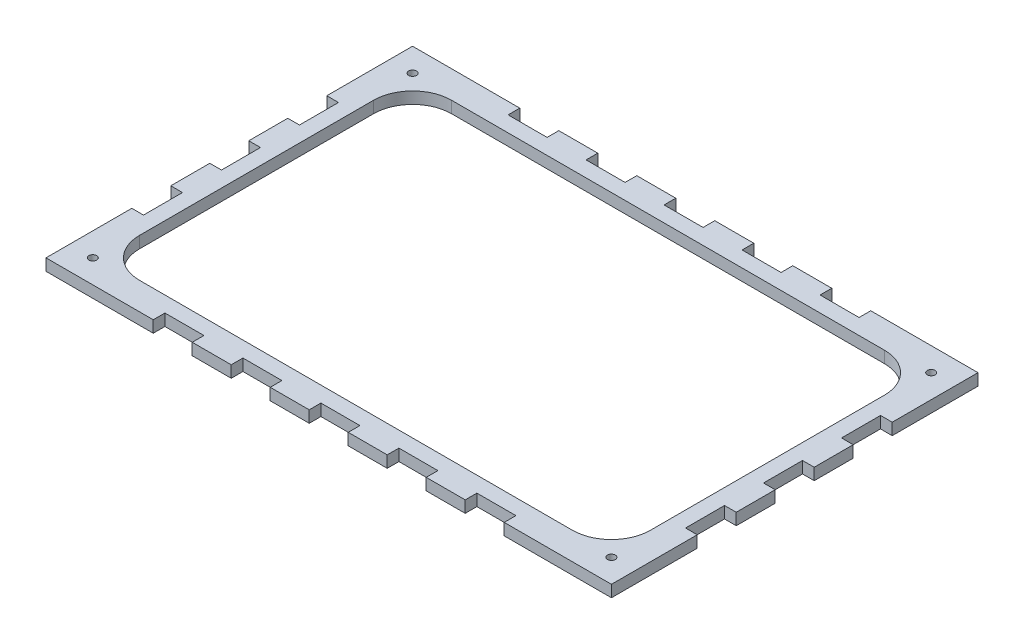
from build123d import *

# Parameters (mm, degrees)
SKETCH1_W           = 145
SKETCH1_H           = 94
BOSS_EXTRUDE1_DEPTH = 3
SKETCH2_W           = 131
SKETCH2_H           = 80
CUT_EXTRUDE1_DEPTH  = 173.829395648
FILLET1_R           = 10
SKETCH3_R           = 1
CUT_EXTRUDE2_DEPTH  = 173.829395648
SKETCH8_W           = 10
SKETCH8_H           = 3
CUT_EXTRUDE5_DEPTH  = 173.829395648
LPATTERN3_COUNT     = 4
LPATTERN3_PITCH     = 20
LPATTERN3_COL_COUNT = 4
LPATTERN3_COL_PITCH = 20
SKETCH9_W           = 3
SKETCH9_H           = 10
CUT_EXTRUDE6_DEPTH  = 173.829395648
LPATTERN4_COUNT     = 3
LPATTERN4_PITCH     = 20
LPATTERN4_COL_COUNT = 3
LPATTERN4_COL_PITCH = 20
SKETCH11_W          = 3
SKETCH11_H          = 10
SKETCH11_W_2        = 10
SKETCH11_H_2        = 3
BOSS_EXTRUDE4_DEPTH = 3


with BuildPart() as part:
    # Sketch1 → Boss-Extrude1 (new body)
    with BuildSketch(Plane(origin=(0, 0, 0), x_dir=(1, 0, 0), z_dir=(0, 1, 0))):
        with Locations((72.5, -47)):
            Rectangle(SKETCH1_W, SKETCH1_H)
    extrude(amount=BOSS_EXTRUDE1_DEPTH)

    # Sketch2 → Cut-Extrude1 (cut, through all)
    with BuildSketch(Plane(origin=(0, 3, 0), x_dir=(1, 0, 0), z_dir=(0, 1, 0))):
        with Locations((72.5, -47)):
            Rectangle(SKETCH2_W, SKETCH2_H)
    extrude(amount=-CUT_EXTRUDE1_DEPTH, mode=Mode.SUBTRACT)

    # Fillet1
    fillet1_edges = [part.edges().sort_by_distance(p)[0] for p in [
        (7, 1.5, 87),
        (7, 1.5, 7),
        (138, 1.5, 7),
        (138, 1.5, 87),
    ]]
    fillet(fillet1_edges, radius=FILLET1_R)

    # Sketch3 → Cut-Extrude2 (cut, through all)
    with BuildSketch(Plane.XZ):
        with Locations(Location((6, 88, 0), (0, 0, 270))):
            Circle(SKETCH3_R)
        with Locations(Location((139, 88, 0), (0, 0, 270))):
            Circle(SKETCH3_R)
        with Locations(Location((139, 6, 0), (0, 0, 270))):
            Circle(SKETCH3_R)
        with Locations(Location((6, 6, 0), (0, 0, 270))):
            Circle(SKETCH3_R)
    extrude(amount=-CUT_EXTRUDE2_DEPTH, mode=Mode.SUBTRACT)

    # Sketch8 → Cut-Extrude5 (cut, through all)
    with BuildSketch(Plane(origin=(0, 0, 0), x_dir=(-1, 0, 0), z_dir=(0, -1, 0))):
        with Locations((-72.5, -92.5)):
            Rectangle(SKETCH8_W, SKETCH8_H)
        with Locations((-72.5, -1.5)):
            Rectangle(SKETCH8_W, SKETCH8_H)
    cut_extrude5 = extrude(amount=-CUT_EXTRUDE5_DEPTH, mode=Mode.SUBTRACT)

    # LPattern3: Cut-Extrude5 ×4
    with Locations(*[(i * LPATTERN3_PITCH, 0, 0) for i in range(1, LPATTERN3_COUNT)]):
        add(cut_extrude5, mode=Mode.SUBTRACT)

    # LPattern3 col: Cut-Extrude5 ×4
    with Locations(*[(-i * LPATTERN3_COL_PITCH, 0, 0) for i in range(1, LPATTERN3_COL_COUNT)]):
        add(cut_extrude5, mode=Mode.SUBTRACT)

    # Sketch9 → Cut-Extrude6 (cut, through all)
    with BuildSketch(Plane(origin=(0, 0, 0), x_dir=(-1, 0, 0), z_dir=(0, -1, 0))):
        with Locations((-1.5, -47)):
            Rectangle(SKETCH9_W, SKETCH9_H)
        with Locations((-143.5, -47)):
            Rectangle(SKETCH9_W, SKETCH9_H)
    cut_extrude6 = extrude(amount=-CUT_EXTRUDE6_DEPTH, mode=Mode.SUBTRACT)

    # LPattern4: Cut-Extrude6 ×3
    with Locations(*[(0, 0, i * LPATTERN4_PITCH) for i in range(1, LPATTERN4_COUNT)]):
        add(cut_extrude6, mode=Mode.SUBTRACT)

    # LPattern4 col: Cut-Extrude6 ×3
    with Locations(*[(0, 0, -i * LPATTERN4_COL_PITCH) for i in range(1, LPATTERN4_COL_COUNT)]):
        add(cut_extrude6, mode=Mode.SUBTRACT)

    # Sketch11 → Boss-Extrude4 (add, through all)
    with BuildSketch(Plane(origin=(0, 0, 0), x_dir=(-1, 0, 0), z_dir=(0, -1, 0))):
        with Locations((-143.5, -87)):
            Rectangle(SKETCH11_W, SKETCH11_H)
        with Locations((-132.5, -92.5)):
            Rectangle(SKETCH11_W_2, SKETCH11_H_2)
        with Locations((-132.5, -1.5)):
            Rectangle(SKETCH11_W_2, SKETCH11_H_2)
        with Locations((-143.5, -7)):
            Rectangle(SKETCH11_W, SKETCH11_H)
        with Locations((-1.5, -7)):
            Rectangle(SKETCH11_W, SKETCH11_H)
        with Locations((-12.5, -1.5)):
            Rectangle(SKETCH11_W_2, SKETCH11_H_2)
        with Locations((-1.5, -87)):
            Rectangle(SKETCH11_W, SKETCH11_H)
        with Locations((-12.5, -92.5)):
            Rectangle(SKETCH11_W_2, SKETCH11_H_2)
    extrude(amount=-BOSS_EXTRUDE4_DEPTH)


solid = part.part
